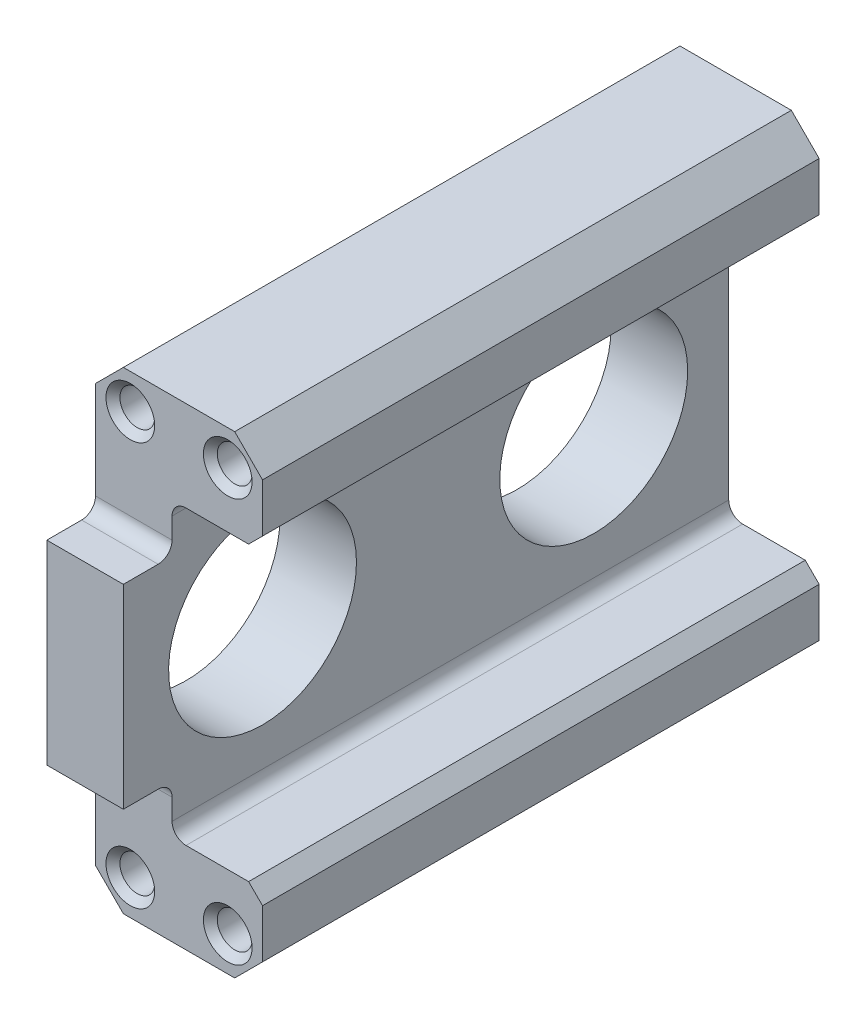
from build123d import *

# Parameters (mm, degrees)
SKETCH_1_W                  = 12
SKETCH_1_H                  = 34
EXTRUDE_1_DEPTH             = 43.5
SKETCH_3_R                  = 6.75
CUT_EXTRUDE_1_DEPTH         = 49.220846115
SKETCH_4_W                  = 12
SKETCH_4_H                  = 10
CUT_EXTRUDE_2_DEPTH         = 3.5
FILLET_1_R                  = 1
HOLE_WIZARD_M3_1_AT_2_COUNT = 2
HOLE_WIZARD_M3_1_AT_2_PITCH = 7
CHAMFER_1_SIZE              = 0.5
SKETCH_7_W                  = 13
SKETCH_7_H                  = 21
CUT_EXTRUDE_3_DEPTH         = 48.087684165
CHAMFER_2_SIZE              = 2
CHAMFER_3_SIZE              = 1
FILLET_2_R                  = 1


with BuildPart() as part:
    # 草图1 → 凸台-拉伸1 (new body)
    with BuildSketch(Plane.XY):
        Rectangle(SKETCH_1_W, SKETCH_1_H)
    extrude(amount=EXTRUDE_1_DEPTH)

    # 草图3 → 切除-拉伸1 (cut, through all)
    with BuildSketch(Plane(origin=(6, 0, 0), x_dir=(0, 0, -1), z_dir=(1, 0, 0))):
        with Locations((-33.5, 0)):
            Circle(SKETCH_3_R)
        with Locations((-9.7, 0)):
            Circle(SKETCH_3_R)
    extrude(amount=-CUT_EXTRUDE_1_DEPTH, mode=Mode.SUBTRACT)

    # 草图4 → 切除-拉伸2 (cut)
    with BuildSketch(Plane.XY.offset(43.5)):
        with Locations((0, 12)):
            Rectangle(SKETCH_4_W, SKETCH_4_H)
    cut_extrude_2 = extrude(amount=-CUT_EXTRUDE_2_DEPTH, mode=Mode.SUBTRACT)

    # 镜向1: 切除-拉伸2 across plane
    add(cut_extrude_2.mirror(Plane.ZX), mode=Mode.SUBTRACT)

    # 圆角1
    fillet_1_edges = [part.edges().sort_by_distance(p)[0] for p in [
        (0, 7, 40),
        (0, -7, 40),
    ]]
    fillet(fillet_1_edges, radius=FILLET_1_R)

    # 草图5 → M3 螺纹孔1 (revolve, cut)
    with BuildSketch(Plane(origin=(3.5, 14.5, 40), x_dir=(0, -1, 0), z_dir=(1, 0, 0))):
        Polygon((0, 0), (0, 10.251075774), (1.25, 9.5), (1.25, 0), align=None)
    hole_wizard_m3_1 = revolve(axis=Axis((3.5, 14.5, 46.35), (0, 0, -1)), mode=Mode.SUBTRACT)

    # M3 螺纹孔1 at 2: M3 螺纹孔1 ×2
    with Locations(*[(-i * HOLE_WIZARD_M3_1_AT_2_PITCH, 0, 0) for i in range(1, HOLE_WIZARD_M3_1_AT_2_COUNT)]):
        add(hole_wizard_m3_1, mode=Mode.SUBTRACT)

    # 镜向2: M3 螺纹孔1 across plane
    add(hole_wizard_m3_1.mirror(Plane.ZX), mode=Mode.SUBTRACT)

    # 镜向2 copy 1 sketch → 镜向2 copy 1 (revolve, cut)
    with BuildSketch(Plane(origin=(-3.5, -14.5, 40), x_dir=(0, 1, 0), z_dir=(1, 0, 0))):
        Polygon((0, 0), (0, -10.251075774), (1.25, -9.5), (1.25, 0), align=None)
    revolve(axis=Axis((-3.5, -14.5, 46.35), (0, 0, 1)), mode=Mode.SUBTRACT)

    # 倒角1
    chamfer_1_edges = [part.edges().sort_by_distance(p)[0] for p in [
        (-3.5, 15.75, 40),
        (3.5, 15.75, 40),
        (-3.5, -15.75, 40),
        (3.5, -15.75, 40),
    ]]
    chamfer(chamfer_1_edges, length=CHAMFER_1_SIZE)

    # 草图7 → 切除-拉伸3 (cut, through all)
    with BuildSketch(Plane(origin=(0, 0, 0), x_dir=(-1, 0, 0), z_dir=(0, 0, -1))):
        with Locations((-6, 0)):
            Rectangle(SKETCH_7_W, SKETCH_7_H)
    extrude(amount=-CUT_EXTRUDE_3_DEPTH, mode=Mode.SUBTRACT)

    # 倒角2
    chamfer_2_edges = [part.edges().sort_by_distance(p)[0] for p in [
        (-6, 17, 20),
        (6, 17, 20),
        (6, -17, 20),
        (-6, -17, 20),
    ]]
    chamfer(chamfer_2_edges, length=CHAMFER_2_SIZE)

    # 倒角3
    chamfer_3_edges = [part.edges().sort_by_distance(p)[0] for p in [
        (6, 10.5, 20),
        (6, -10.5, 20),
    ]]
    chamfer(chamfer_3_edges, length=CHAMFER_3_SIZE)

    # 圆角2
    fillet_2_edges = [part.edges().sort_by_distance(p)[0] for p in [
        (-0.5, -10.5, 20),
        (-0.5, 10.5, 20),
    ]]
    fillet(fillet_2_edges, radius=FILLET_2_R)


solid = part.part
